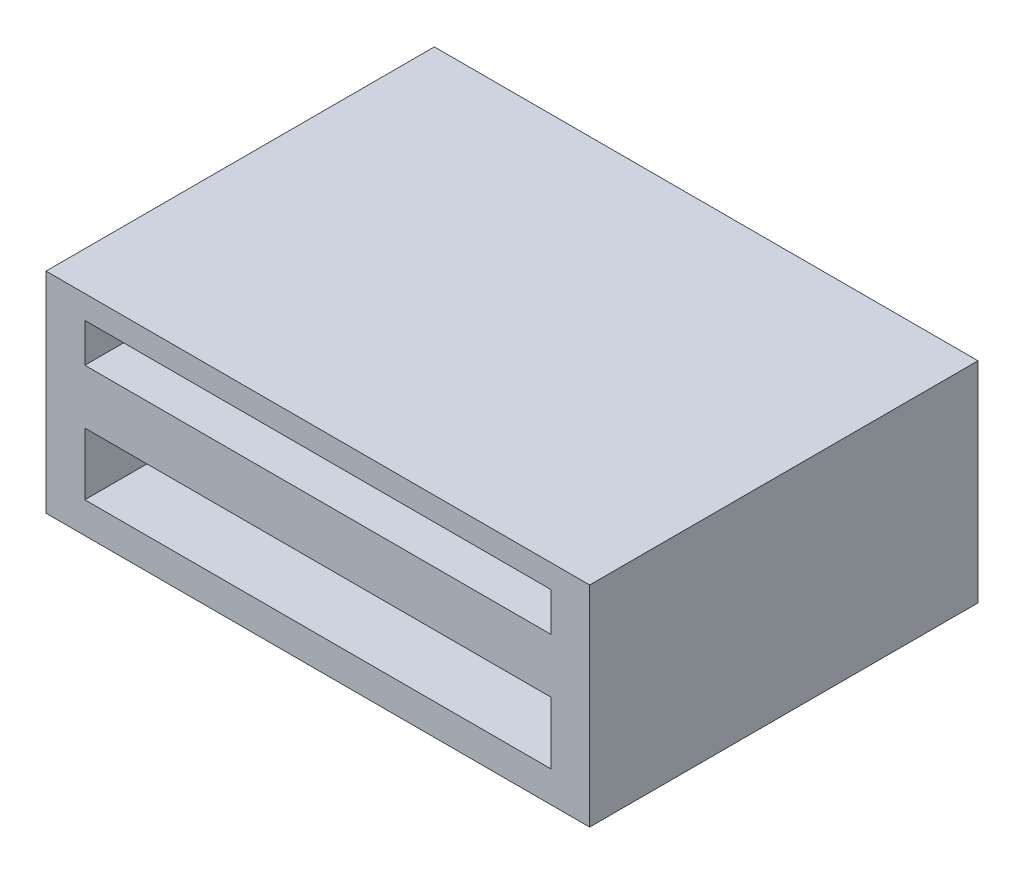
from build123d import *

# Parameters (mm, degrees)
SKETCH2_W           = 70
SKETCH2_H           = 27
SKETCH2_W_2         = 60
SKETCH2_H_2         = 8
SKETCH2_H_3         = 5
BOSS_EXTRUDE1_DEPTH = 50


with BuildPart() as part:
    # Sketch2 → Boss-Extrude1 (new body)
    with BuildSketch(Plane.XY):
        with Locations((35, 13.5)):
            Rectangle(SKETCH2_W, SKETCH2_H)
        with Locations((35, 8)):
            Rectangle(SKETCH2_W_2, SKETCH2_H_2, mode=Mode.SUBTRACT)
        with Locations((35, 21.5)):
            Rectangle(SKETCH2_W_2, SKETCH2_H_3, mode=Mode.SUBTRACT)
    extrude(amount=BOSS_EXTRUDE1_DEPTH)


solid = part.part
